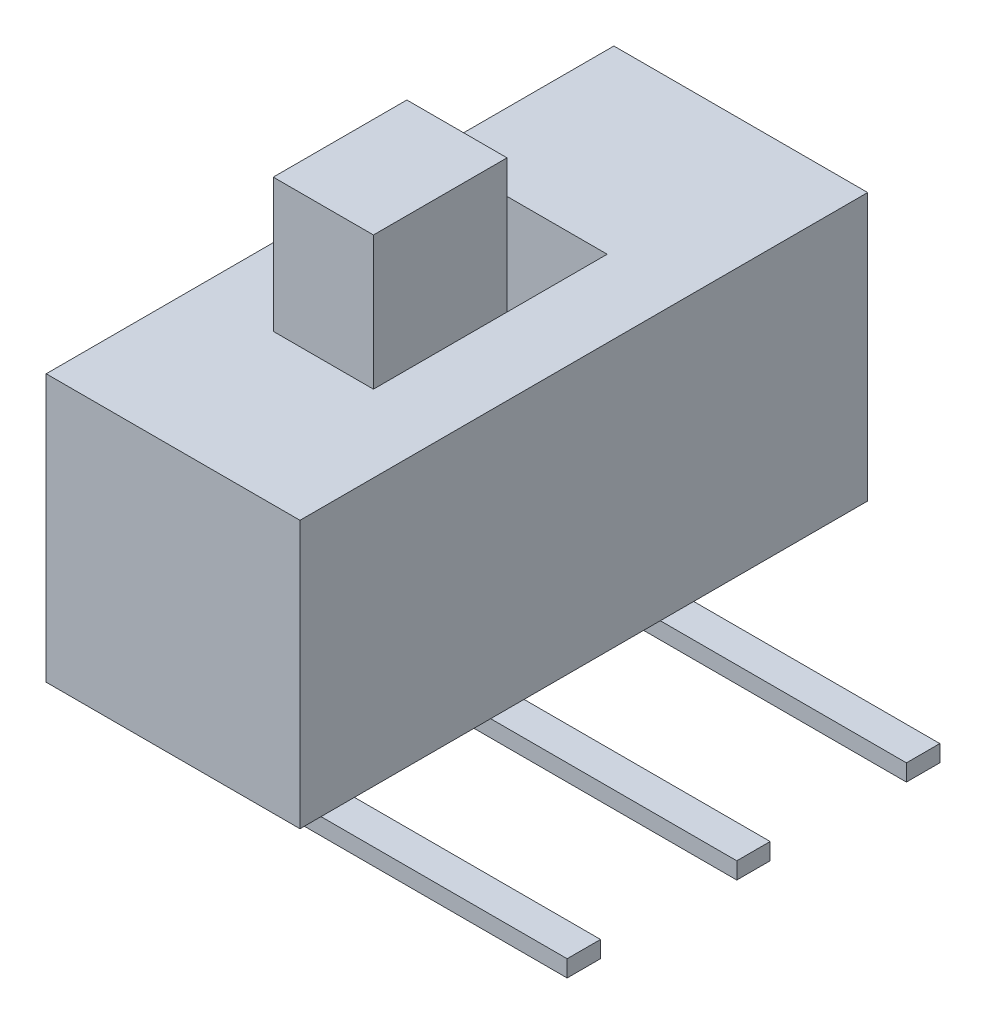
from build123d import *

# Parameters (mm, degrees)
SKETCH_1_W          = 3.8
SKETCH_1_H          = 8.5
EXTRUDE_1_DEPTH     = 4
SKETCH_2_W          = 1.5
SKETCH_2_H          = 2
EXTRUDE_2_DEPTH     = 2
SKETCH_5_W          = 1.5
SKETCH_5_H          = 3.5
CUT_EXTRUDE_1_DEPTH = 2
SKETCH_7_W          = 0.25
SKETCH_7_H          = 0.5


with BuildPart() as part:
    # 草图1 → 拉伸1 (new body)
    with BuildSketch(Plane(origin=(0, 0, 0), x_dir=(1, 0, 0), z_dir=(0, 1, 0))):
        Rectangle(SKETCH_1_W, SKETCH_1_H)
    extrude(amount=EXTRUDE_1_DEPTH)

    # 草图2 → 拉伸2 (add)
    with BuildSketch(Plane(origin=(0, 4, 0), x_dir=(-1, 0, 0), z_dir=(0, 1, 0))):
        with Locations((0, 1)):
            Rectangle(SKETCH_2_W, SKETCH_2_H)
    extrude(amount=EXTRUDE_2_DEPTH)

    # 草图5 → 切除-拉伸1 (cut)
    with BuildSketch(Plane(origin=(0, 4, 0), x_dir=(-1, 0, 0), z_dir=(0, 1, 0))):
        with Locations((0, 0.25)):
            Rectangle(SKETCH_5_W, SKETCH_5_H)
    extrude(amount=-CUT_EXTRUDE_1_DEPTH, mode=Mode.SUBTRACT)


with BuildPart() as cut_extrude_1_piece_1:
    # of the separate pieces the step leaves, piece 1, a body of its own (cut_extrude_1_pieces)
    add(part.part.solids().sort_by_distance((-1.9, 0, -4.25))[0])

    # 扫描1: sweep along a path in 草图9
    with BuildLine(Plane.XY.offset(4.25)) as sweep_1_path:
        Line((0, 0), (0, -1.27))
        Line((0, -1.27), (4.44, -1.27))
    # 草图7 → 扫描1 (sweep)
    with BuildSketch(Plane.XZ):
        with Locations((0, 2.54)):
            Rectangle(SKETCH_7_W, SKETCH_7_H)
        Rectangle(SKETCH_7_W, SKETCH_7_H)
        with Locations((0, -2.54)):
            Rectangle(SKETCH_7_W, SKETCH_7_H)
    sweep(path=sweep_1_path.line, transition=Transition.RIGHT)


with BuildPart() as cut_extrude_1_piece_2:
    # of the separate pieces the step leaves, piece 2, a body of its own (cut_extrude_1_pieces)
    add(part.part.solids().sort_by_distance((-0.75, 6, 2))[0])


solid = Compound([cut_extrude_1_piece_1.part, cut_extrude_1_piece_2.part])
